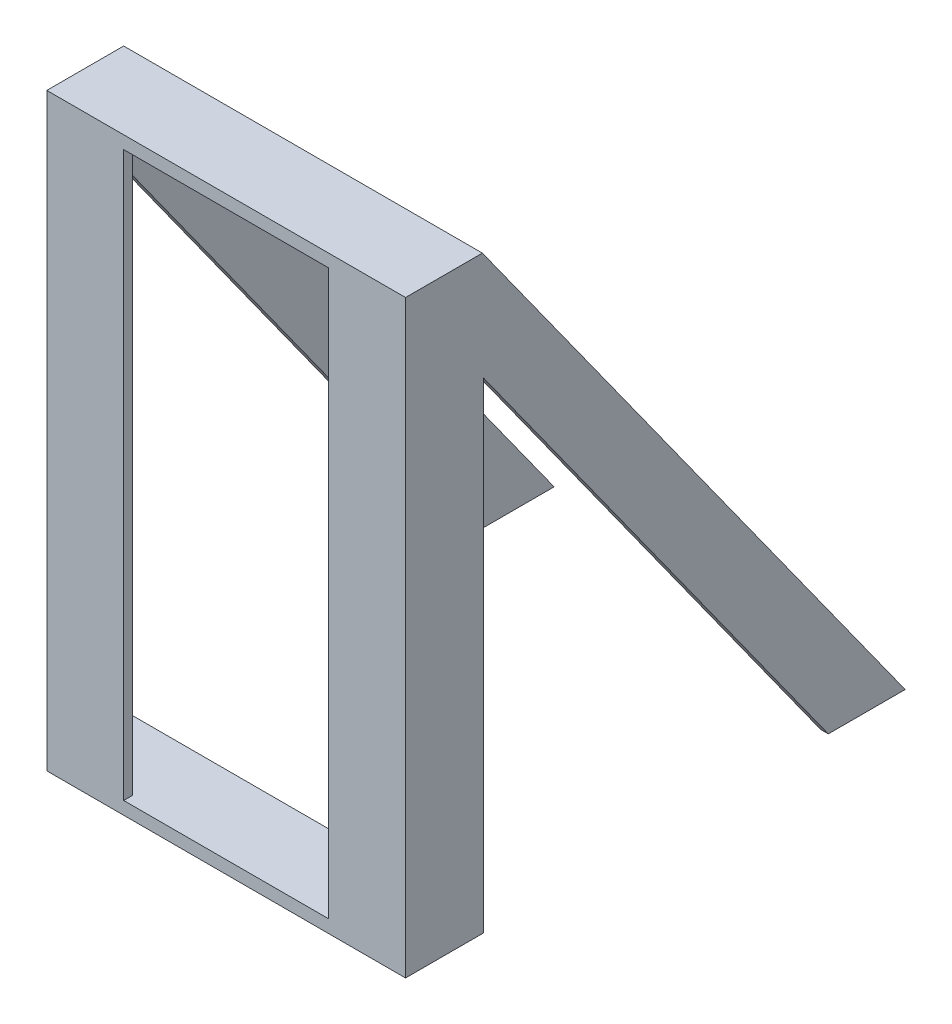
from build123d import *

# Parameters (mm, degrees)
BOSS_EXTRUDE1_DEPTH = 225
BOSS_EXTRUDE2_DEPTH = 5
BOSS_EXTRUDE3_DEPTH = 220
SKETCH4_W           = 140
SKETCH4_H           = 30
BOSS_EXTRUDE4_DEPTH = 5
BOSS_EXTRUDE5_DEPTH = 3
BOSS_EXTRUDE6_DEPTH = 3


with BuildPart() as part:
    # Sketch1 → Boss-Extrude1 (new body)
    with BuildSketch(Plane(origin=(0, 0, 0), x_dir=(1, 0, 0), z_dir=(0, 1, 0))):
        Polygon((0, 0), (0, 30), (3.4, 30), (3.4, 3.4), (30, 3.4), (30, 0), align=None)
    extrude(amount=BOSS_EXTRUDE1_DEPTH)

    # Sketch2 → Boss-Extrude2 (add)
    with BuildSketch(Plane(origin=(0, 0, 0), x_dir=(-1, 0, 0), z_dir=(0, -1, 0))):
        Polygon((-140, 0), (-30, 0), (-30, 3.4), (-3.4, 3.4), (-3.4, 30), (0, 30), (0, 30.423390593), (-140, 30.423390593), align=None)
    extrude(amount=-BOSS_EXTRUDE2_DEPTH)

    # Sketch3 → Boss-Extrude3 (add)
    with BuildSketch(Plane(origin=(0, 5, 0), x_dir=(1, 0, 0), z_dir=(0, 1, 0))):
        Polygon((140, 0), (140, 30.423390593), (136.6, 30.423390593), (136.6, 3.4), (110, 3.4), (110, 0), align=None)
    extrude(amount=BOSS_EXTRUDE3_DEPTH)

    # Sketch4 → Boss-Extrude4 (add)
    with BuildSketch(Plane(origin=(0, 225, 0), x_dir=(1, 0, 0), z_dir=(0, 1, 0))):
        with Locations((70, 15)):
            Rectangle(SKETCH4_W, SKETCH4_H)
    extrude(amount=BOSS_EXTRUDE4_DEPTH)

    # Sketch5 → Boss-Extrude5 (add)
    with BuildSketch(Plane(origin=(140, 0, 0), x_dir=(0, 0, -1), z_dir=(1, 0, 0))):
        Polygon((143.47826087, 30), (165, 0), (195, 0), (30, 230), (30, 225), (30.423390593, 225), (30.423390593, 187.591637355), align=None)
    extrude(amount=-BOSS_EXTRUDE5_DEPTH)

    # Sketch6 → Boss-Extrude6 (add)
    with BuildSketch(Plane.ZY):
        Polygon((-30, 230), (-195, 0), (-165, 0), (0, 230), align=None)
    extrude(amount=-BOSS_EXTRUDE6_DEPTH)


solid = part.part
